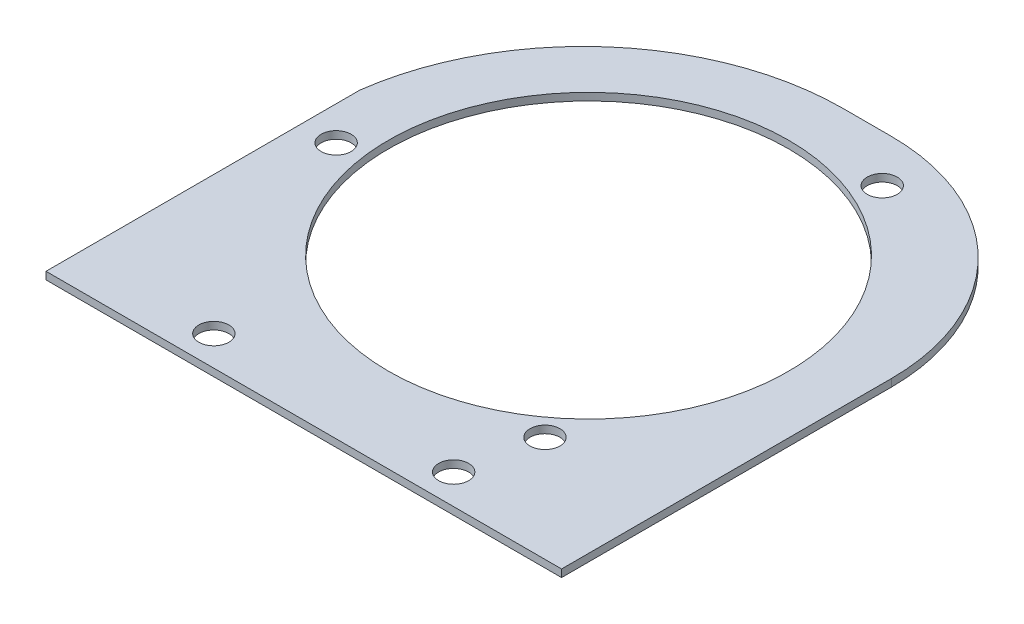
from build123d import *

# Parameters (mm, degrees)
SKETCH1_R           = 84.7725
SKETCH1_R_2         = 6.35
BOSS_EXTRUDE1_DEPTH = 3.175


with BuildPart() as part:
    # Sketch1 → Boss-Extrude1 (new body)
    with BuildSketch(Plane(origin=(0, 0, 0), x_dir=(1, 0, 0), z_dir=(0, 1, 0))):
        with BuildLine():
            Line((16.751670796, 110.565701996), (-3.568329204, 110.565701996))
            ThreePointArc((-3.568329204, 110.565701996), (-76.150812933, 83.28188355), (-112.788329204, 14.942172584))
            Line((-112.788329204, 14.942172584), (-112.788329204, -118.034298004))
            Line((-112.788329204, -118.034298004), (105.651670796, -118.034298004))
            Line((105.651670796, -118.034298004), (105.651670796, 21.665701996))
            ThreePointArc((105.651670796, 21.665701996), (79.613463644, 84.527494844), (16.751670796, 110.565701996))
        make_face()
        with Locations(Location((-3.568329204, 2.615701996, 0), (0, 0, 270))):
            Circle(SKETCH1_R, mode=Mode.SUBTRACT)
        with Locations(Location((-98.436496288, -9.450545061, 0), (0, 0, 270))):
            Circle(SKETCH1_R_2, mode=Mode.SUBTRACT)
        with Locations(Location((-54.368329204, -105.334298004, 0), (0, 0, 270))):
            Circle(SKETCH1_R_2, mode=Mode.SUBTRACT)
        with Locations(Location((47.231670796, -105.334298004, 0), (0, 0, 90))):
            Circle(SKETCH1_R_2, mode=Mode.SUBTRACT)
        with Locations(Location((32.954821111, 90.521109482, 0), (0, 0, 270))):
            Circle(SKETCH1_R_2, mode=Mode.SUBTRACT)
        with Locations(Location((53.837154904, -73.252936494, 0), (0, 0, 270))):
            Circle(SKETCH1_R_2, mode=Mode.SUBTRACT)
    extrude(amount=BOSS_EXTRUDE1_DEPTH)


solid = part.part
